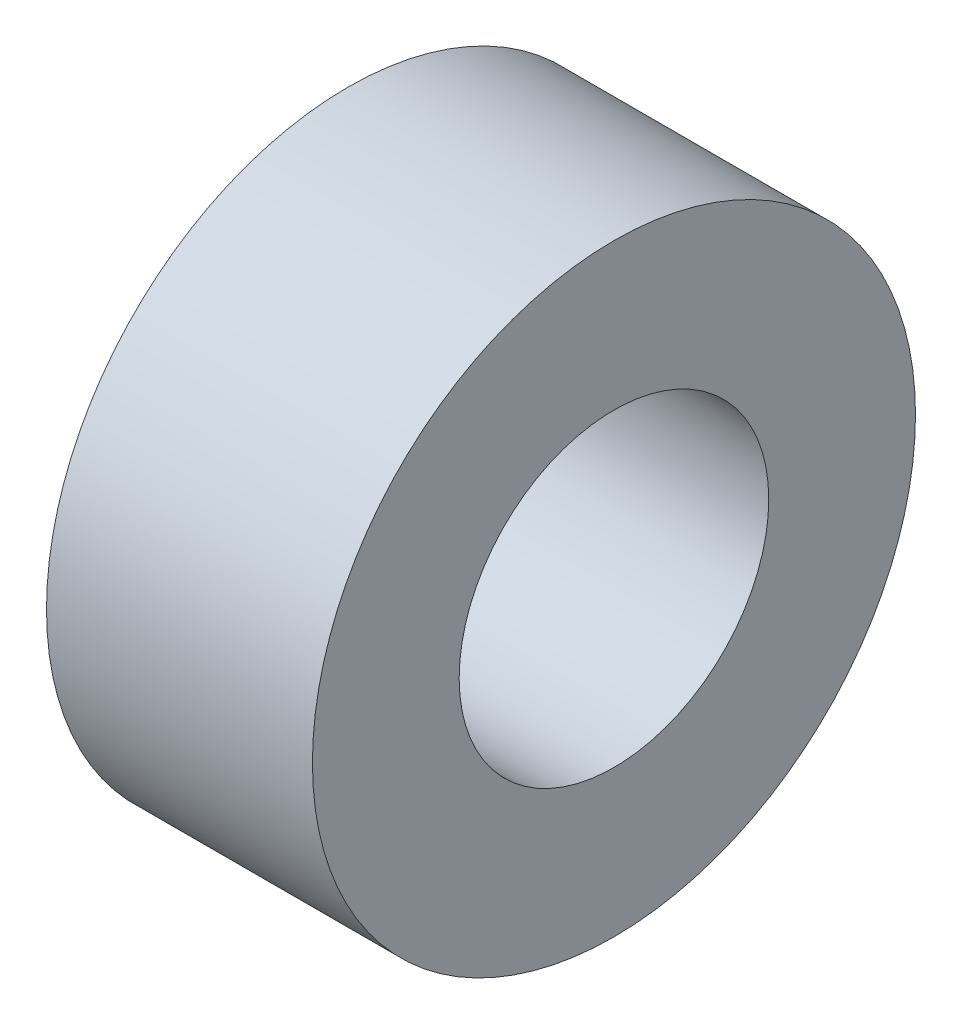
from build123d import *

# Parameters (mm, degrees)
SKETCH1_R           = 7.9375
BOSS_EXTRUDE1_DEPTH = 7
SKETCH2_R           = 4.075
CUT_EXTRUDE1_DEPTH  = 15


with BuildPart() as part:
    # Sketch1 → Boss-Extrude1 (new body)
    with BuildSketch(Plane(origin=(0, 0, 0), x_dir=(0, 0, -1), z_dir=(1, 0, 0))):
        Circle(SKETCH1_R)
    extrude(amount=BOSS_EXTRUDE1_DEPTH)

    # Sketch2 → Cut-Extrude1 (cut)
    with BuildSketch(Plane(origin=(7, 0, 0), x_dir=(0, 0, -1), z_dir=(1, 0, 0))):
        Circle(SKETCH2_R)
    extrude(amount=-CUT_EXTRUDE1_DEPTH, mode=Mode.SUBTRACT)


solid = part.part
